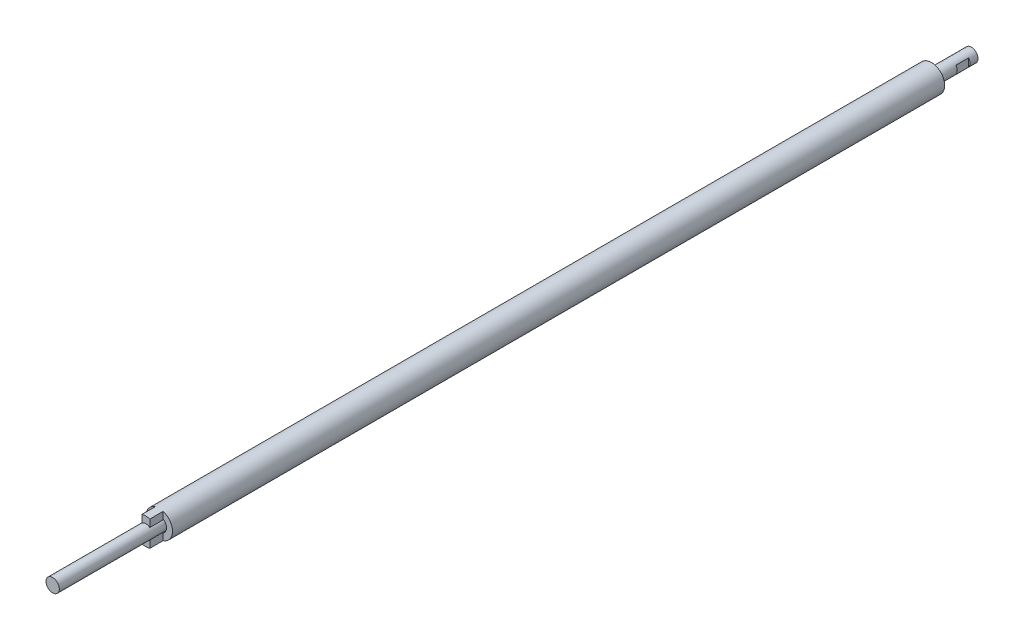
from build123d import *
from build123d.topology import SkipClean

# Parameters (mm, degrees)
SKETCH_1_R          = 2.5
EXTRUDE_1_DEPTH     = 345
CUT_EXTRUDE_1_DEPTH = 4.8
SKETCH_3_R          = 5
SKETCH_3_R_2        = 2.75
EXTRUDE_2_DEPTH     = 290
SKETCH_4_R          = 5
EXTRUDE_3_DEPTH     = 5
CUT_EXTRUDE_START   = -5
CUT_EXTRUDE_2_DEPTH = 5


with BuildPart() as part:
    # 草图1 → 凸台-拉伸1 (new body)
    with BuildSketch(Plane.XY):
        Circle(SKETCH_1_R)
    extrude(amount=EXTRUDE_1_DEPTH)

    # 草图2 → 切除-拉伸1 (cut)
    with BuildSketch(Plane(origin=(0, 0, 3), x_dir=(-1, 0, 0), z_dir=(0, 0, -1))):
        with BuildLine():
            Line((-2, 1.5), (-2, -1.5))
            ThreePointArc((-2, -1.5), (-2.5, 0), (-2, 1.5))
        make_face()
    extrude(amount=-CUT_EXTRUDE_1_DEPTH, mode=Mode.SUBTRACT)



with BuildPart() as body_2:
    # 草图3 → 凸台-拉伸2 (new body)
    with BuildSketch(Plane.XY.offset(305)):
        Circle(SKETCH_3_R)
        Circle(SKETCH_3_R_2, mode=Mode.SUBTRACT)
    extrude(amount=-EXTRUDE_2_DEPTH)


with BuildPart() as part_1:
    add(part.part)

    add(body_2.part)  # 凸台-拉伸3 merges body 2
    # 草图4 → 凸台-拉伸3 (add)
    with BuildSketch(Plane.XY.offset(305)):
        Circle(SKETCH_4_R)
    extrude(amount=EXTRUDE_3_DEPTH)

    # 草图5 → 切除-拉伸2 (cut)
    with SkipClean():  # the faces are left unmerged after this step: merging them gives an invalid solid
        with BuildSketch(Plane.XY.offset(310).offset(CUT_EXTRUDE_START)):
            with BuildLine():
                Line((-1.5, 4.769696007), (-1.5, 2))
                ThreePointArc((-1.5, 2), (-2.5, 0), (-1.5, -2))
                Line((-1.5, -2), (-1.5, -4.769696007))
                ThreePointArc((-1.5, -4.769696007), (-5, 0), (-1.5, 4.769696007))
            make_face()
            with BuildLine():
                Line((1.5, 4.769696007), (1.5, 2))
                ThreePointArc((1.5, 2), (2.5, 0), (1.5, -2))
                Line((1.5, -2), (1.5, -4.769696007))
                ThreePointArc((1.5, -4.769696007), (5, 0), (1.5, 4.769696007))
            make_face()
        extrude(amount=CUT_EXTRUDE_2_DEPTH, mode=Mode.SUBTRACT)


solid = part_1.part
